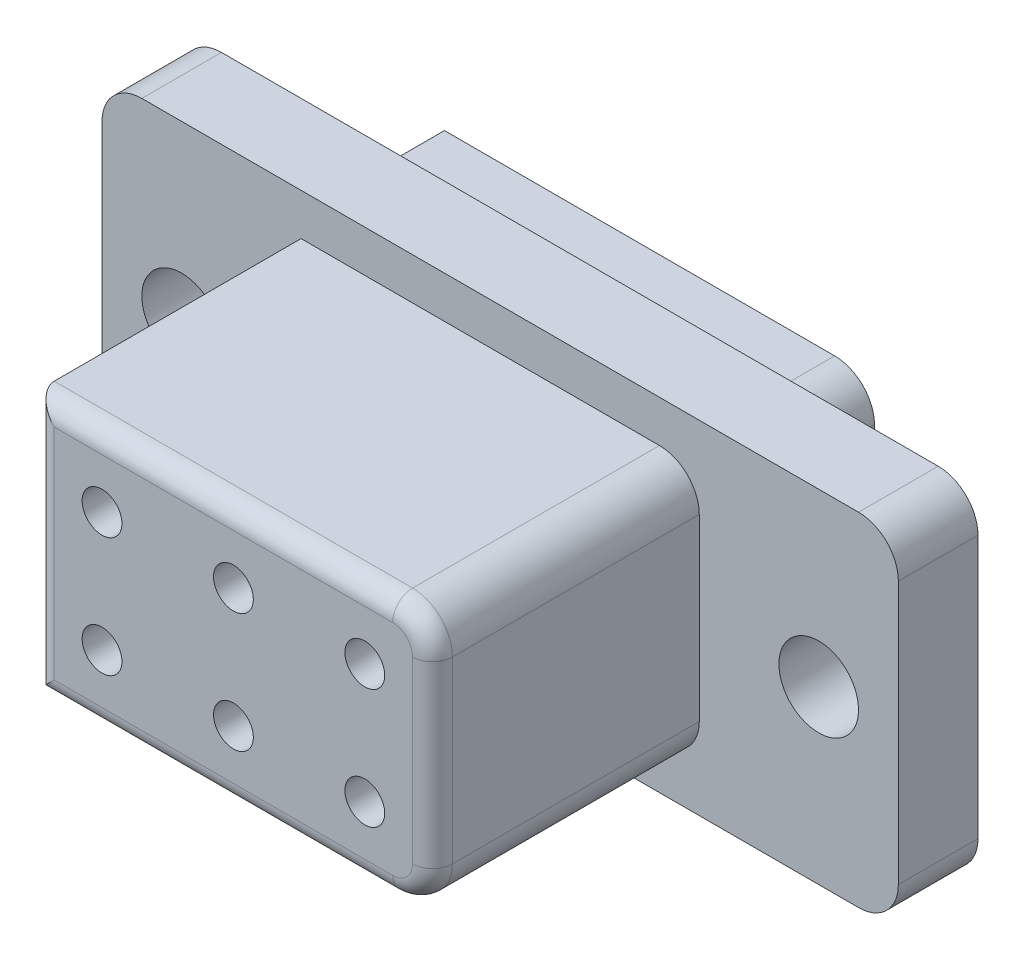
from build123d import *

# Parameters (mm, degrees)
SKETCH_2_W      = 10
SKETCH_2_H      = 6.5
SKETCH_2_R      = 0.5
EXTRUDE_1_DEPTH = 6.7
SKETCH_4_W      = 20
SKETCH_4_H      = 8.6
SKETCH_4_R      = 1
EXTRUDE_2_DEPTH = 2
EXTRUDE_START   = 2
SKETCH_7_W      = 10.8
SKETCH_7_H      = 6.8
SKETCH_7_R      = 0.5
EXTRUDE_3_DEPTH = 2
FILLET_1_R      = 1
FILLET_2_R      = 1
FILLET_4_R      = 0.5


with BuildPart() as part:
    # 草图2 → 凸台-拉伸1 (new body)
    with BuildSketch(Plane.XY):
        Rectangle(SKETCH_2_W, SKETCH_2_H)
        with Locations((-3.3, 1.5)):
            Circle(SKETCH_2_R, mode=Mode.SUBTRACT)
        with Locations((0, 1.5)):
            Circle(SKETCH_2_R, mode=Mode.SUBTRACT)
        with Locations((3.3, 1.5)):
            Circle(SKETCH_2_R, mode=Mode.SUBTRACT)
        with Locations((0, -1.5)):
            Circle(SKETCH_2_R, mode=Mode.SUBTRACT)
        with Locations((3.3, -1.5)):
            Circle(SKETCH_2_R, mode=Mode.SUBTRACT)
        with Locations((-3.3, -1.5)):
            Circle(SKETCH_2_R, mode=Mode.SUBTRACT)
    extrude(amount=EXTRUDE_1_DEPTH)

    # 草图4 → 凸台-拉伸2 (add)
    with BuildSketch(Plane.XY):
        Rectangle(SKETCH_4_W, SKETCH_4_H)
        with Locations((-8, 0)):
            Circle(SKETCH_4_R, mode=Mode.SUBTRACT)
        with Locations(Location((8, 0, 0), (0, 0, 180))):
            Circle(SKETCH_4_R, mode=Mode.SUBTRACT)
    extrude(amount=-EXTRUDE_2_DEPTH)

    # 草图7 → 凸台-拉伸3 (add)
    with BuildSketch(Plane(origin=(0, 0, -2), x_dir=(-1, 0, 0), z_dir=(0, 0, -1)).offset(EXTRUDE_START)):
        Rectangle(SKETCH_7_W, SKETCH_7_H)
        with Locations(Location((-3.3, 1.5, 0), (0, 0, 180))):
            Circle(SKETCH_7_R, mode=Mode.SUBTRACT)
        with Locations(Location((0, 1.5, 0), (0, 0, 180))):
            Circle(SKETCH_7_R, mode=Mode.SUBTRACT)
        with Locations(Location((3.3, 1.5, 0), (0, 0, 180))):
            Circle(SKETCH_7_R, mode=Mode.SUBTRACT)
        with Locations(Location((0, -1.5, 0), (0, 0, 180))):
            Circle(SKETCH_7_R, mode=Mode.SUBTRACT)
        with Locations(Location((3.3, -1.5, 0), (0, 0, 180))):
            Circle(SKETCH_7_R, mode=Mode.SUBTRACT)
        with Locations(Location((-3.3, -1.5, 0), (0, 0, 180))):
            Circle(SKETCH_7_R, mode=Mode.SUBTRACT)
    extrude(amount=-EXTRUDE_3_DEPTH)

    # 圆角1
    fillet_1_edges = [part.edges().sort_by_distance(p)[0] for p in [
        (10, 4.3, -1),
        (10, -4.3, -1),
        (-10, -4.3, -1),
        (-10, 4.3, -1),
    ]]
    fillet(fillet_1_edges, radius=FILLET_1_R)

    # 圆角2
    fillet_2_edges = [part.edges().sort_by_distance(p)[0] for p in [
        (5, -3.25, 3.35),
        (5, 3.25, 3.35),
        (5.4, 3.4, -3),
        (5.4, -3.4, -3),
    ]]
    fillet(fillet_2_edges, radius=FILLET_2_R)

    # 圆角4
    fillet_4_edges = [part.edges().sort_by_distance(p)[0] for p in [
        (-5, 0, 6.7),
        (5, 0, 6.7),
        (-0.5, 3.25, 6.7),
        (4.707106781, 2.957106781, 6.7),
        (4.707106781, -2.957106781, 6.7),
        (-0.5, -3.25, 6.7),
    ]]
    fillet(fillet_4_edges, radius=FILLET_4_R)


solid = part.part
